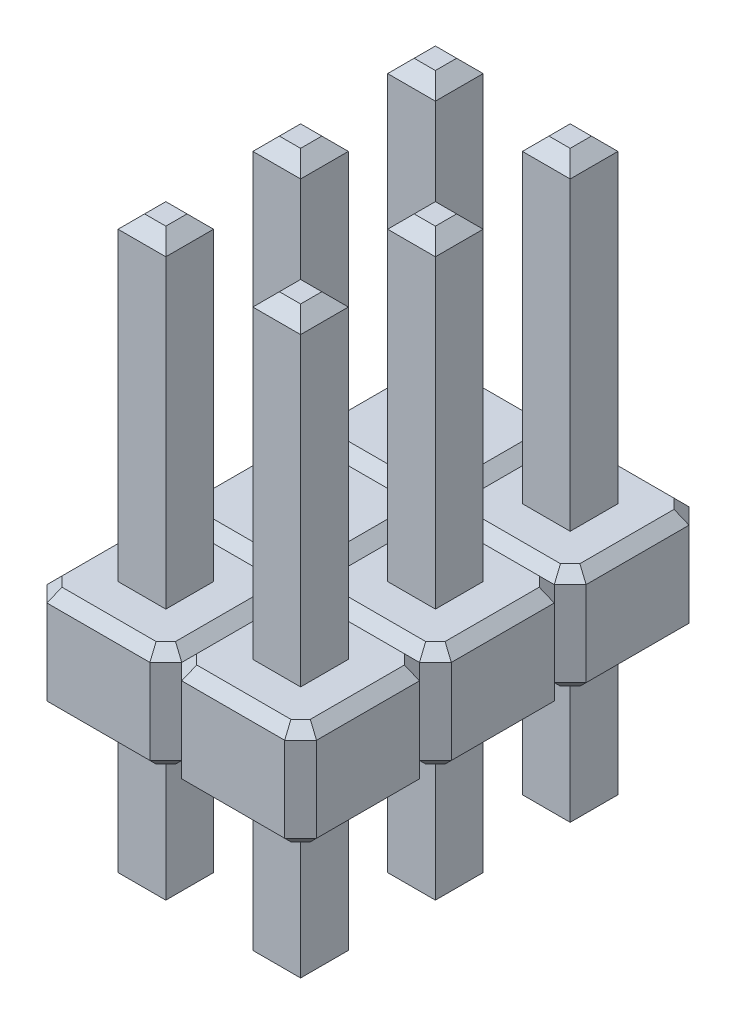
from build123d import *

# Parameters (mm, degrees)
SKETCH_1_W               = 0.9
SKETCH_1_H               = 0.9
METAL_PART_DEPTH         = 11
PLASTIC_START            = 3
PLASTIC_PART_DEPTH       = 2
CHAMFER_1_SIZE           = 0.2
CHAMFER_2_SIZE           = 0.25
PATTERN_LINEAR_1_COUNT   = 3
PATTERN_LINEAR_1_PITCH   = 2.54
PATTERN_LINEAR_1_2_COUNT = 2
PATTERN_LINEAR_1_2_PITCH = 2.54


with BuildPart() as part:
    # Эскиз1 → metal part (new body)
    with BuildSketch(Plane(origin=(0, 0, 0), x_dir=(1, 0, 0), z_dir=(0, 1, 0))):
        Rectangle(SKETCH_1_W, SKETCH_1_H)
    extrude(amount=METAL_PART_DEPTH)

    # Фаска2
    chamfer_2_edges = [part.edges().sort_by_distance(p)[0] for p in [
        (0, 0, 0.45),
        (0.45, 0, 0),
        (0, 0, -0.45),
        (-0.45, 0, 0),
        (0.45, 11, 0),
        (0, 11, -0.45),
        (0, 11, 0.45),
        (-0.45, 11, 0),
    ]]
    chamfer(chamfer_2_edges, length=CHAMFER_2_SIZE)


with BuildPart() as body_2:
    # Эскиз1<3> → plastic part (new body)
    with BuildSketch(Plane(origin=(0, 0, 0), x_dir=(1, 0, 0), z_dir=(0, 1, 0)).offset(PLASTIC_START)):
        Polygon((-0.97, -1.27), (0.97, -1.27), (1.27, -0.97), (1.27, 0.97), (0.97, 1.27), (-0.97, 1.27), (-1.27, 0.97), (-1.27, -0.97), align=None)
    extrude(amount=PLASTIC_PART_DEPTH)

    # Фаска1
    chamfer_1_edges = [body_2.edges().sort_by_distance(p)[0] for p in [
        (1.12, 3, -1.12),
        (1.27, 3, 0),
        (1.12, 3, 1.12),
        (0, 3, 1.27),
        (-1.12, 3, 1.12),
        (-1.27, 3, 0),
        (-1.12, 3, -1.12),
        (0, 3, -1.27),
        (1.12, 5, -1.12),
        (0, 5, -1.27),
        (-1.12, 5, -1.12),
        (-1.27, 5, 0),
        (-1.12, 5, 1.12),
        (1.27, 5, 0),
        (1.12, 5, 1.12),
        (0, 5, 1.27),
    ]]
    chamfer(chamfer_1_edges, length=CHAMFER_1_SIZE)


with BuildPart() as pattern_linear_1_1:
    # Линейный массив1: pattern copy
    add(part.part.moved(Location(Vector(0, 0, -1) * (1 * PATTERN_LINEAR_1_PITCH))))


with BuildPart() as pattern_linear_1_2:
    # Линейный массив1: pattern copy
    add(part.part.moved(Location(Vector(0, 0, -1) * (2 * PATTERN_LINEAR_1_PITCH))))


with BuildPart() as pattern_linear_1_3:
    # Линейный массив1: pattern copy
    add(body_2.part.moved(Location(Vector(0, 0, -1) * (1 * PATTERN_LINEAR_1_PITCH))))


with BuildPart() as pattern_linear_1_4:
    # Линейный массив1: pattern copy
    add(body_2.part.moved(Location(Vector(0, 0, -1) * (2 * PATTERN_LINEAR_1_PITCH))))


with BuildPart() as pattern_linear_1_2_1:
    # Pattern Linear 1 2: pattern copy
    add(part.part.moved(Location(Vector(1, 0, 0) * (1 * PATTERN_LINEAR_1_2_PITCH))))


with BuildPart() as pattern_linear_1_2_2:
    # Pattern Linear 1 2: pattern copy
    add(body_2.part.moved(Location(Vector(1, 0, 0) * (1 * PATTERN_LINEAR_1_2_PITCH))))


with BuildPart() as pattern_linear_1_2_3:
    # Pattern Linear 1 2: pattern copy
    add(pattern_linear_1_1.part.moved(Location(Vector(1, 0, 0) * (1 * PATTERN_LINEAR_1_2_PITCH))))


with BuildPart() as pattern_linear_1_2_4:
    # Pattern Linear 1 2: pattern copy
    add(pattern_linear_1_2.part.moved(Location(Vector(1, 0, 0) * (1 * PATTERN_LINEAR_1_2_PITCH))))


with BuildPart() as pattern_linear_1_2_5:
    # Pattern Linear 1 2: pattern copy
    add(pattern_linear_1_3.part.moved(Location(Vector(1, 0, 0) * (1 * PATTERN_LINEAR_1_2_PITCH))))


with BuildPart() as pattern_linear_1_2_6:
    # Pattern Linear 1 2: pattern copy
    add(pattern_linear_1_4.part.moved(Location(Vector(1, 0, 0) * (1 * PATTERN_LINEAR_1_2_PITCH))))


with BuildPart() as pattern_linear_1_3_1:
    add(pattern_linear_1_3.part)

    # Combine 2: union Линейный массив1 2_5, Линейный массив1 2_6, Линейный массив1_4, body 2, Линейный массив1 2_2
    add(pattern_linear_1_2_5.part)
    add(pattern_linear_1_2_6.part)
    add(pattern_linear_1_4.part)
    add(body_2.part)
    add(pattern_linear_1_2_2.part)


solid = Compound([part.part, pattern_linear_1_1.part, pattern_linear_1_2.part, pattern_linear_1_2_1.part, pattern_linear_1_2_3.part, pattern_linear_1_2_4.part, pattern_linear_1_3_1.part])
